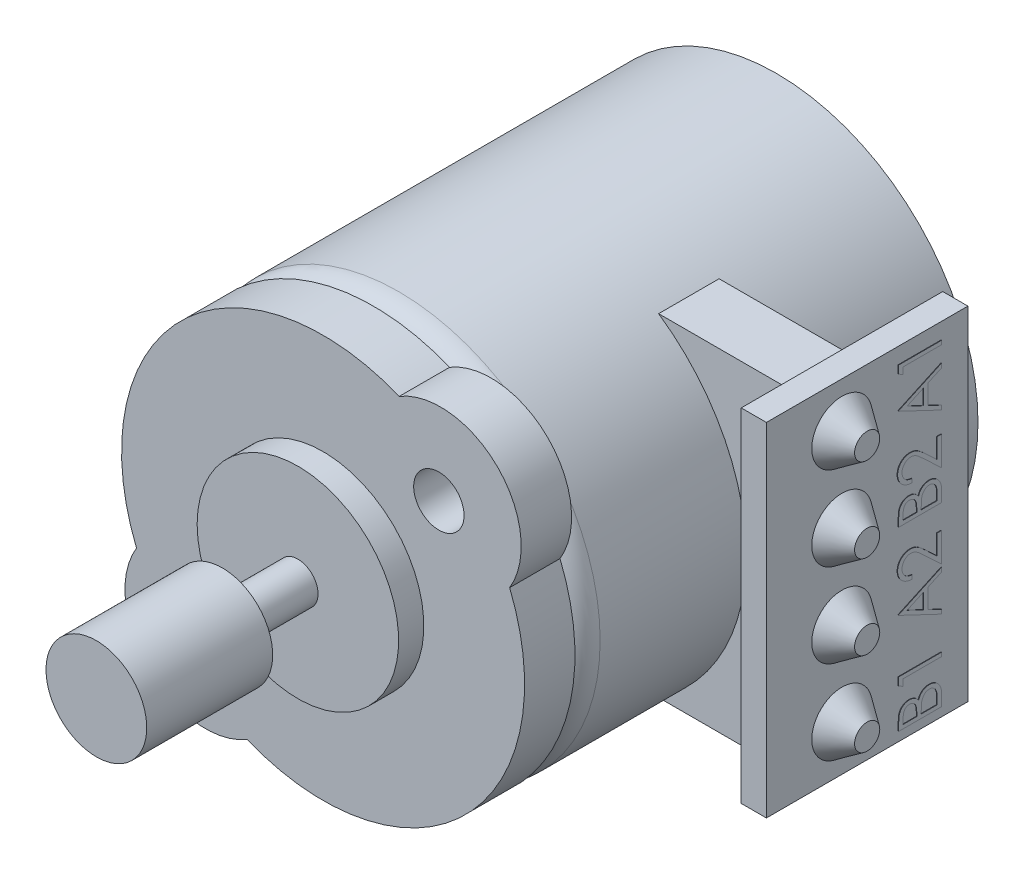
from build123d import *

# Parameters (mm, degrees)
EXTRUDE_5_DEPTH           = 1
CUT_EXTRUDE_START         = -1
SKETCH_8_R                = 0.5
CUT_EXTRUDE_1_DEPTH       = 1
SKETCH_3_W                = 1.2
SKETCH_3_H                = 6.6
EXTRUDE_1_DEPTH           = 4.8
SKETCH_4_W                = 4
SKETCH_4_H                = 6.8
EXTRUDE_2_DEPTH           = 0.5
SKETCH_5_R                = 0.6
EXTRUDE_3_DEPTH           = 0.5
EXTRUDE_3_DRAFT           = 35
EXTRUDE_3_PROFILE_2_DEPTH = 0.5
EXTRUDE_3_PROFILE_2_DRAFT = 35
EXTRUDE_3_PROFILE_3_DEPTH = 0.5
EXTRUDE_3_PROFILE_3_DRAFT = 35
EXTRUDE_3_PROFILE_4_DEPTH = 0.5
EXTRUDE_3_PROFILE_4_DRAFT = 35
EXTRUDE_4_DEPTH           = 0.01


with BuildPart() as part:
    # Эскиз2 → Повернуть1 (revolve)
    with BuildSketch(Plane(origin=(0, 0, 0), x_dir=(1, 0, 0), z_dir=(0, 1, 0))):
        with BuildLine():
            Line((0, 0), (-3.5, 0))
            Line((-3.5, 0), (-3.5, -0.2))
            Line((-3.5, -0.2), (-4, -0.2))
            Line((-4, -0.2), (-4, -7.7))
            ThreePointArc((-4, -7.7), (-3.853553391, -8.053553391), (-3.5, -8.2))
            Line((-3.5, -8.2), (-4, -8.2))
            Line((-4, -8.2), (-4, -9.2))
            Line((-4, -9.2), (-2, -9.2))
            Line((-2, -9.2), (-2, -9.7))
            Line((-2, -9.7), (-0.4, -9.7))
            Line((-0.4, -9.7), (-0.4, -11.2))
            Line((-0.4, -11.2), (-1, -11.2))
            Line((-1, -11.2), (-1, -13.7))
            Line((-1, -13.7), (0, -13.7))
            Line((0, -13.7), (0, 0))
        make_face()
    revolve(axis=Axis((0, 0, 0), (0, 0, 1)))

    # Эскиз7 → Бобышка-Вытянуть5 (add)
    with BuildSketch(Plane.XY.offset(9.2)):
        with BuildLine():
            ThreePointArc((3.703456785, 1.511425764), (3.464823228, 3.464823228), (1.511425764, 3.703456785))
            ThreePointArc((1.511425764, 3.703456785), (2.828427125, 2.828427125), (3.703456785, 1.511425764))
        make_face()
        with BuildLine():
            ThreePointArc((-1.511425764, -3.703456785), (-3.464823228, -3.464823228), (-3.703456785, -1.511425764))
            ThreePointArc((-3.703456785, -1.511425764), (-2.828427125, -2.828427125), (-1.511425764, -3.703456785))
        make_face()
    extrude(amount=-EXTRUDE_5_DEPTH)

    # Эскиз8 → Вырез-Вытянуть1 (cut)
    with BuildSketch(Plane.XY.offset(9.2).offset(CUT_EXTRUDE_START)):
        with Locations((-2.298097039, -2.298097039)):
            Circle(SKETCH_8_R)
        with Locations((2.298097039, 2.298097039)):
            Circle(SKETCH_8_R)
    extrude(amount=CUT_EXTRUDE_1_DEPTH, mode=Mode.SUBTRACT)

    # Эскиз3 → Бобышка-Вытянуть1 (add)
    with BuildSketch(Plane(origin=(0, 0, 0), x_dir=(0, 0, -1), z_dir=(1, 0, 0))):
        with Locations((-4.2, 0)):
            Rectangle(SKETCH_3_W, SKETCH_3_H)
    extrude(amount=EXTRUDE_1_DEPTH)

    # Эскиз4 → Бобышка-Вытянуть2 (add)
    with BuildSketch(Plane(origin=(4.8, 0, 0), x_dir=(0, 0, -1), z_dir=(1, 0, 0))):
        with Locations((-3.7, 0)):
            Rectangle(SKETCH_4_W, SKETCH_4_H)
    extrude(amount=EXTRUDE_2_DEPTH)


with BuildPart() as extrude_3_tool:
    # Эскиз5 → Бобышка-Вытянуть3 (with draft: the straight prism first)
    with BuildSketch(Plane(origin=(5.3, 0, 0), x_dir=(0, 0, -1), z_dir=(1, 0, 0))):
        with Locations((-4.2, -2.5)):
            Circle(SKETCH_5_R)
    extrude(amount=EXTRUDE_3_DEPTH)
    # Бобышка-Вытянуть3: the draft: its side faces are tilted about the plane it starts from
    extrude_3_sides = [extrude_3_tool.faces().sort_by_distance(p)[0] for p in [
        (5.55, -2.5, 4.8),
    ]]
    draft(extrude_3_sides, Plane(origin=(5.3, 0, 0), x_dir=(0, 0, -1), z_dir=(1, 0, 0)), EXTRUDE_3_DRAFT)


with BuildPart() as part_1:
    add(part.part)

    # Бобышка-Вытянуть3: add extrude_3_tool
    add(extrude_3_tool.part)


with BuildPart() as extrude_3_profile_2_tool:
    # Эскиз5 → Бобышка-Вытянуть3 profile 2 (with draft: the straight prism first)
    with BuildSketch(Plane(origin=(5.3, 0, 0), x_dir=(0, 0, -1), z_dir=(1, 0, 0))):
        with Locations((-4.2, -0.833333333)):
            Circle(SKETCH_5_R)
    extrude(amount=EXTRUDE_3_PROFILE_2_DEPTH)
    # Бобышка-Вытянуть3 profile 2: the draft: its side faces are tilted about the plane it starts from
    extrude_3_profile_2_sides = [extrude_3_profile_2_tool.faces().sort_by_distance(p)[0] for p in [
        (5.55, -0.833333333, 4.8),
    ]]
    draft(extrude_3_profile_2_sides, Plane(origin=(5.3, 0, 0), x_dir=(0, 0, -1), z_dir=(1, 0, 0)), EXTRUDE_3_PROFILE_2_DRAFT)


with BuildPart() as part_2:
    add(part_1.part)

    # Бобышка-Вытянуть3 profile 2: add extrude_3_profile_2_tool
    add(extrude_3_profile_2_tool.part)


with BuildPart() as extrude_3_profile_3_tool:
    # Эскиз5 → Бобышка-Вытянуть3 profile 3 (with draft: the straight prism first)
    with BuildSketch(Plane(origin=(5.3, 0, 0), x_dir=(0, 0, -1), z_dir=(1, 0, 0))):
        with Locations((-4.2, 0.833333333)):
            Circle(SKETCH_5_R)
    extrude(amount=EXTRUDE_3_PROFILE_3_DEPTH)
    # Бобышка-Вытянуть3 profile 3: the draft: its side faces are tilted about the plane it starts from
    extrude_3_profile_3_sides = [extrude_3_profile_3_tool.faces().sort_by_distance(p)[0] for p in [
        (5.55, 0.833333333, 4.8),
    ]]
    draft(extrude_3_profile_3_sides, Plane(origin=(5.3, 0, 0), x_dir=(0, 0, -1), z_dir=(1, 0, 0)), EXTRUDE_3_PROFILE_3_DRAFT)


with BuildPart() as part_3:
    add(part_2.part)

    # Бобышка-Вытянуть3 profile 3: add extrude_3_profile_3_tool
    add(extrude_3_profile_3_tool.part)


with BuildPart() as extrude_3_profile_4_tool:
    # Эскиз5 → Бобышка-Вытянуть3 profile 4 (with draft: the straight prism first)
    with BuildSketch(Plane(origin=(5.3, 0, 0), x_dir=(0, 0, -1), z_dir=(1, 0, 0))):
        with Locations((-4.2, 2.5)):
            Circle(SKETCH_5_R)
    extrude(amount=EXTRUDE_3_PROFILE_4_DEPTH)
    # Бобышка-Вытянуть3 profile 4: the draft: its side faces are tilted about the plane it starts from
    extrude_3_profile_4_sides = [extrude_3_profile_4_tool.faces().sort_by_distance(p)[0] for p in [
        (5.55, 2.5, 4.8),
    ]]
    draft(extrude_3_profile_4_sides, Plane(origin=(5.3, 0, 0), x_dir=(0, 0, -1), z_dir=(1, 0, 0)), EXTRUDE_3_PROFILE_4_DRAFT)


with BuildPart() as part_4:
    add(part_3.part)

    # Бобышка-Вытянуть3 profile 4: add extrude_3_profile_4_tool
    add(extrude_3_profile_4_tool.part)

    # Эскиз6 → Бобышка-Вытянуть4 (add)
    # profile 1 of 8: a face of its own
    with BuildSketch(Plane(origin=(5.3, 0, 0), x_dir=(0, 0, 1), z_dir=(1, 0, 0))):
        Polygon((3.083442392, -2.926812901), (3.083442392, -3.083974359), (2.233442392, -3.083974359), (2.233442392, -3.007692308), (2.996262905, -3.007692308), (2.996262905, -2.876923077), align=None)
    # profile 2 of 8: a face of its own
    with BuildSketch(Plane(origin=(5.3, 0, 0), x_dir=(0, 0, 1), z_dir=(1, 0, 0))):
        Polygon((3.083442392, -2.299358974), (2.233442392, -2.691666667), (2.233442392, -2.60874399), (2.50587829, -2.483082933), (2.50587829, -2.09775641), (2.233442392, -1.968519631), (2.233442392, -1.88525641), (3.083442392, -2.288461538), align=None)
        Polygon((2.917767312, -2.293058894), (2.593057777, -2.139132612), (2.593057777, -2.442898638), align=None, mode=Mode.SUBTRACT)
    # profile 3 of 8: a face of its own
    with BuildSketch(Plane(origin=(5.3, 0, 0), x_dir=(0, 0, 1), z_dir=(1, 0, 0))):
        with BuildLine():
            Line((2.821903931, -1.002564103), (2.821903931, -0.926282051))
            add(Edge.make_bspline(
                [(2.821903931, -0.926282051), (2.832024054, -0.926779132), (2.851899705, -0.927755386), (2.880877662, -0.932329168), (2.908579239, -0.938867619), (2.934766947, -0.948134129), (2.959753618, -0.959577459), (2.98320746, -0.973587407), (3.005361248, -0.989865303), (3.025795539, -1.008381284), (3.044475035, -1.028472831), (3.060776435, -1.050019562), (3.074391942, -1.07280002), (3.08583609, -1.096616615), (3.094415882, -1.121744793), (3.100784743, -1.147944359), (3.104615937, -1.175333729), (3.105027799, -1.193994857), (3.105237264, -1.203485577)],
                knots=[0, 0, 0, 0, 1.100776268, 2.161895295, 3.184016182, 4.190939212, 5.176500551, 6.166955529, 7.155448256, 8.160289653, 9.16017456, 10.133824356, 11.091467644, 12.04088621, 13.000931625, 13.972173743, 14.968683325, 16, 16, 16, 16], degree=3))
            add(Edge.make_bspline(
                [(3.105237264, -1.203485577), (3.105019068, -1.212805966), (3.104590319, -1.231120199), (3.100908355, -1.257849545), (3.095141568, -1.283295459), (3.087050682, -1.307408203), (3.076174464, -1.32999539), (3.063109347, -1.351226701), (3.047998817, -1.371354897), (3.030208605, -1.389473688), (3.011216597, -1.406111364), (2.990940963, -1.420464769), (2.969999565, -1.432756537), (2.948232716, -1.443002117), (2.925435467, -1.450544322), (2.901939717, -1.456270458), (2.877502263, -1.459507116), (2.8609621, -1.460003861), (2.852552969, -1.46025641)],
                knots=[0, 0, 0, 0, 1.111607364, 2.184268762, 3.212621178, 4.221274766, 5.211760367, 6.196651075, 7.1921475, 8.207485113, 9.220403448, 10.201281604, 11.166441695, 12.114753415, 13.065576456, 14.026450734, 14.996634279, 16, 16, 16, 16], degree=3))
            add(Edge.make_bspline(
                [(2.852552969, -1.46025641), (2.84071421, -1.459845189), (2.817244443, -1.459029964), (2.78275512, -1.452056472), (2.749339575, -1.441165177), (2.72244623, -1.428051533), (2.700775239, -1.414822511), (2.682932839, -1.402901259), (2.663721511, -1.388945519), (2.643205586, -1.37275217), (2.621224366, -1.354656186), (2.59779113, -1.334493661), (2.573147986, -1.312120815), (2.556316626, -1.296418037), (2.547595037, -1.28828125)],
                knots=[0, 0, 0, 0, 1.184426356, 2.348067706, 3.509069118, 4.696110526, 5.333549288, 6.050745305, 6.844228056, 7.710549037, 8.667450064, 9.695053472, 10.805634456, 12, 12, 12, 12], degree=3))
            Line((2.547595037, -1.28828125), (2.32062188, -1.075610978))
            Line((2.32062188, -1.075610978), (2.32062188, -1.471153846))
            Line((2.32062188, -1.471153846), (2.233442392, -1.471153846))
            Line((2.233442392, -1.471153846), (2.233442392, -0.893589744))
            Line((2.233442392, -0.893589744), (2.585225245, -1.223237179))
            add(Edge.make_bspline(
                [(2.585225245, -1.223237179), (2.593602948, -1.231263663), (2.609694802, -1.246680895), (2.633195532, -1.26847776), (2.654971885, -1.288086339), (2.675120357, -1.305519641), (2.693526723, -1.32079201), (2.710335232, -1.33385458), (2.725401636, -1.344765087), (2.743101018, -1.35632795), (2.764736561, -1.367353908), (2.791043331, -1.377044596), (2.818183975, -1.382911207), (2.836519264, -1.383618556), (2.845742072, -1.383974359)],
                knots=[0, 0, 0, 0, 1.329530082, 2.553755191, 3.672934919, 4.687409497, 5.60679272, 6.413407421, 7.126401618, 7.737995624, 8.834647426, 9.90044882, 10.943907757, 12, 12, 12, 12], degree=3))
            add(Edge.make_bspline(
                [(2.845742072, -1.383974359), (2.851542481, -1.38382155), (2.862973974, -1.383520394), (2.879723319, -1.380812198), (2.895942662, -1.37683332), (2.911431462, -1.37070064), (2.926494354, -1.363332452), (2.940673379, -1.353919047), (2.954451865, -1.343161998), (2.96735736, -1.330684348), (2.979180797, -1.316986207), (2.989653565, -1.302512848), (2.998405979, -1.287200803), (3.005580813, -1.271113883), (3.011209124, -1.254297135), (3.015109064, -1.23671798), (3.017557667, -1.218425005), (3.017888966, -1.205934014), (3.018057777, -1.199569311)],
                knots=[0, 0, 0, 0, 0.991504627, 1.954065223, 2.895985987, 3.842598665, 4.797835564, 5.759220273, 6.74786863, 7.784730864, 8.824135544, 9.839918996, 10.835834653, 11.835434876, 12.84861661, 13.863796685, 14.911511676, 16, 16, 16, 16], degree=3))
            add(Edge.make_bspline(
                [(3.018057777, -1.199569311), (3.017884179, -1.192922079), (3.017543261, -1.179868014), (3.015157012, -1.160702381), (3.011044305, -1.142417169), (3.005405872, -1.124975362), (2.99830704, -1.108360155), (2.989294538, -1.092721784), (2.978720248, -1.077917474), (2.966666134, -1.063974416), (2.953182179, -1.051162934), (2.938336136, -1.039669993), (2.922031432, -1.029867729), (2.904636342, -1.021178464), (2.885688352, -1.01452989), (2.865646615, -1.008846753), (2.844226386, -1.004718374), (2.829468334, -1.00329412), (2.821903931, -1.002564103)],
                knots=[0, 0, 0, 0, 1.031212865, 2.025131798, 2.990757446, 3.934781266, 4.865570067, 5.788494791, 6.729227313, 7.684356718, 8.643577152, 9.610526866, 10.590658432, 11.59095419, 12.621640561, 13.700587263, 14.82141059, 16, 16, 16, 16], degree=3))
        make_face()
    # profile 4 of 8: a face of its own
    with BuildSketch(Plane(origin=(5.3, 0, 0), x_dir=(0, 0, 1), z_dir=(1, 0, 0))):
        with BuildLine():
            Line((3.083442392, -0.294230769), (3.083442392, -0.460076122))
            add(Edge.make_bspline(
                [(3.083442392, -0.460076122), (3.08339971, -0.468194466), (3.083316981, -0.483929839), (3.082033935, -0.506811703), (3.080284473, -0.528243557), (3.077508593, -0.548231616), (3.074159161, -0.566766644), (3.070103006, -0.583904499), (3.0652394, -0.599590684), (3.057505303, -0.618318062), (3.046012534, -0.639670223), (3.029029882, -0.662789833), (3.008257712, -0.682559434), (2.98482621, -0.699604682), (2.95905038, -0.713156383), (2.931544577, -0.722960355), (2.902663583, -0.729167267), (2.882835954, -0.729805601), (2.872815389, -0.730128205)],
                knots=[0, 0, 0, 0, 1.001505555, 1.941167018, 2.826882275, 3.653841531, 4.429895133, 5.150066043, 5.825578002, 6.45369114, 7.647487171, 8.808567382, 9.977351308, 11.170798116, 12.373658725, 13.556498008, 14.765093433, 16, 16, 16, 16], degree=3))
            add(Edge.make_bspline(
                [(2.872815389, -0.730128205), (2.86342675, -0.72986784), (2.844977187, -0.729356199), (2.818036129, -0.724297084), (2.792284881, -0.716764782), (2.768040902, -0.705830106), (2.745615781, -0.691764729), (2.725142789, -0.674838671), (2.707118071, -0.654685986), (2.697083281, -0.639562868), (2.691986062, -0.63188101)],
                knots=[0, 0, 0, 0, 1.044266239, 2.052081639, 3.041743201, 4.026043445, 5.00270663, 5.980942822, 6.97441044, 8, 8, 8, 8], degree=3))
            add(Edge.make_bspline(
                [(2.691986062, -0.63188101), (2.688281709, -0.641538731), (2.681194364, -0.660016343), (2.668595841, -0.685462263), (2.655047505, -0.707473548), (2.640173733, -0.726074426), (2.6239409, -0.741742788), (2.606674061, -0.755813302), (2.587523145, -0.767601237), (2.567033461, -0.777728068), (2.545348814, -0.785697778), (2.522568379, -0.79133687), (2.498946881, -0.794801818), (2.482846429, -0.795274298), (2.474718434, -0.795512821)],
                knots=[0, 0, 0, 0, 1.272302504, 2.434229863, 3.488457646, 4.447234501, 5.35599188, 6.26022912, 7.18267843, 8.11661068, 9.06895546, 10.019249207, 11.000057067, 12, 12, 12, 12], degree=3))
            add(Edge.make_bspline(
                [(2.474718434, -0.795512821), (2.466420812, -0.795275512), (2.450095009, -0.794808601), (2.426110947, -0.791365957), (2.403193787, -0.785531266), (2.381180584, -0.777514081), (2.360195941, -0.766991194), (2.339977043, -0.754461178), (2.321062508, -0.739210561), (2.303002526, -0.722211589), (2.286773993, -0.702958425), (2.272326092, -0.682188782), (2.260389666, -0.659603924), (2.250488109, -0.635554083), (2.242814453, -0.609879446), (2.237487045, -0.582675208), (2.233889073, -0.55393546), (2.233593812, -0.534212949), (2.233442392, -0.524098558)],
                knots=[0, 0, 0, 0, 0.978404568, 1.925038397, 2.85041836, 3.763147166, 4.682162379, 5.614488577, 6.562659439, 7.54271123, 8.535210642, 9.526693784, 10.520907202, 11.541451354, 12.589717429, 13.675358278, 14.807842563, 16, 16, 16, 16], degree=3))
            Line((2.233442392, -0.524098558), (2.233442392, -0.294230769))
            Line((2.233442392, -0.294230769), (3.083442392, -0.294230769))
        make_face()
        with BuildLine():
            Line((2.996262905, -0.370512821), (2.723827008, -0.370512821))
            Line((2.723827008, -0.370512821), (2.723827008, -0.421764824))
            add(Edge.make_bspline(
                [(2.723827008, -0.421764824), (2.723923324, -0.429256741), (2.724109426, -0.443732653), (2.724659322, -0.464751767), (2.726131628, -0.484213687), (2.727688835, -0.502185476), (2.730086615, -0.51854668), (2.733020824, -0.533352071), (2.736096889, -0.546734647), (2.741342895, -0.562160682), (2.749017334, -0.579653602), (2.761207495, -0.598183192), (2.775332452, -0.614783756), (2.791931389, -0.628645018), (2.810053751, -0.640082982), (2.829701154, -0.647716183), (2.850106569, -0.653130311), (2.86415184, -0.653605095), (2.871282937, -0.653846154)],
                knots=[0, 0, 0, 0, 1.156481963, 2.23455883, 3.244418989, 4.168404366, 5.01828131, 5.794834307, 6.498111525, 7.13526334, 8.307595709, 9.435046769, 10.546766856, 11.659452936, 12.760769924, 13.837671619, 14.902137667, 16, 16, 16, 16], degree=3))
            add(Edge.make_bspline(
                [(2.871282937, -0.653846154), (2.876002847, -0.65372559), (2.885261464, -0.653489092), (2.898706408, -0.651336676), (2.911513191, -0.648213499), (2.923387266, -0.643334144), (2.934666129, -0.637433995), (2.94484881, -0.629758972), (2.954493176, -0.621091269), (2.96324511, -0.610911895), (2.971086878, -0.59927014), (2.977986946, -0.586055079), (2.983429917, -0.571108917), (2.988312551, -0.554770543), (2.991700567, -0.536778473), (2.9945334, -0.517308517), (2.995973407, -0.496195503), (2.996164254, -0.481588878), (2.996262905, -0.474038462)],
                knots=[0, 0, 0, 0, 0.911752476, 1.788502045, 2.626783689, 3.45400582, 4.26402138, 5.080402872, 5.911472738, 6.767166405, 7.66795952, 8.620018292, 9.640966946, 10.73819047, 11.913090943, 13.176185384, 14.540321519, 16, 16, 16, 16], degree=3))
            Line((2.996262905, -0.474038462), (2.996262905, -0.370512821))
        make_face(mode=Mode.SUBTRACT)
        with BuildLine():
            Line((2.636647521, -0.370512821), (2.32062188, -0.370512821))
            Line((2.32062188, -0.370512821), (2.32062188, -0.479146635))
            add(Edge.make_bspline(
                [(2.32062188, -0.479146635), (2.32071475, -0.486922698), (2.320893745, -0.501910035), (2.321484469, -0.523548392), (2.322799924, -0.54354971), (2.324944467, -0.561925498), (2.327172834, -0.578837514), (2.330257001, -0.594117736), (2.333763326, -0.607789589), (2.33918953, -0.623640436), (2.347604845, -0.641500967), (2.360375987, -0.660734962), (2.375390489, -0.678006299), (2.392986932, -0.692504722), (2.411975199, -0.704476951), (2.432255974, -0.712873774), (2.453210552, -0.71827281), (2.467534708, -0.718910807), (2.474718434, -0.719230769)],
                knots=[0, 0, 0, 0, 1.159821618, 2.235403267, 3.228114831, 4.14795534, 4.994323282, 5.771256229, 6.471395042, 7.097801288, 8.267864287, 9.404187171, 10.531774336, 11.667624178, 12.792825787, 13.866573821, 14.930062559, 16, 16, 16, 16], degree=3))
            add(Edge.make_bspline(
                [(2.474718434, -0.719230769), (2.479210255, -0.71916537), (2.488121443, -0.719035626), (2.501206814, -0.717005355), (2.513938743, -0.714172994), (2.526124705, -0.710071491), (2.537962992, -0.704899829), (2.5492474, -0.69840959), (2.560247742, -0.690914593), (2.574138682, -0.67918994), (2.590148851, -0.662152324), (2.605821658, -0.637936433), (2.618462005, -0.610403553), (2.623828998, -0.590433963), (2.626601447, -0.580118189)],
                knots=[0, 0, 0, 0, 0.723503378, 1.435336582, 2.130201219, 2.824764462, 3.504949994, 4.209866579, 4.920640069, 5.648298893, 7.13757748, 8.670694625, 10.280166878, 12, 12, 12, 12], degree=3))
            add(Edge.make_bspline(
                [(2.626601447, -0.580118189), (2.627440595, -0.575982555), (2.629260042, -0.567015648), (2.631179399, -0.552393733), (2.632901126, -0.535644762), (2.63414125, -0.516840322), (2.635472501, -0.495905626), (2.635971801, -0.4728474), (2.636581224, -0.447649343), (2.636624856, -0.43016546), (2.636647521, -0.421083734)],
                knots=[0, 0, 0, 0, 0.634452549, 1.375623993, 2.216454381, 3.166361212, 4.209414599, 5.370755378, 6.634280627, 8, 8, 8, 8], degree=3))
            Line((2.636647521, -0.421083734), (2.636647521, -0.370512821))
        make_face(mode=Mode.SUBTRACT)
    # profile 5 of 8: a face of its own
    with BuildSketch(Plane(origin=(5.3, 0, 0), x_dir=(0, 0, 1), z_dir=(1, 0, 0))):
        with BuildLine():
            Line((2.821903931, 0.653846154), (2.821903931, 0.730128205))
            add(Edge.make_bspline(
                [(2.821903931, 0.730128205), (2.832024054, 0.729631124), (2.851899705, 0.72865487), (2.880877662, 0.724081088), (2.908579239, 0.717542637), (2.934766947, 0.708276127), (2.959753618, 0.696832797), (2.98320746, 0.682822849), (3.005361248, 0.666544954), (3.025795539, 0.648028972), (3.044475035, 0.627937426), (3.060776435, 0.606390694), (3.074391942, 0.583610237), (3.08583609, 0.559793642), (3.094415882, 0.534665463), (3.100784743, 0.508465898), (3.104615937, 0.481076527), (3.105027799, 0.4624154), (3.105237264, 0.452924679)],
                knots=[0, 0, 0, 0, 1.100776268, 2.161895295, 3.184016182, 4.190939212, 5.176500551, 6.166955529, 7.155448256, 8.160289653, 9.16017456, 10.133824356, 11.091467644, 12.04088621, 13.000931625, 13.972173743, 14.968683325, 16, 16, 16, 16], degree=3))
            add(Edge.make_bspline(
                [(3.105237264, 0.452924679), (3.105019068, 0.44360429), (3.104590319, 0.425290058), (3.100908355, 0.398560711), (3.095141568, 0.373114797), (3.087050682, 0.349002054), (3.076174464, 0.326414867), (3.063109347, 0.305183556), (3.047998817, 0.285055359), (3.030208605, 0.266936569), (3.011216597, 0.250298892), (2.990940963, 0.235945487), (2.969999565, 0.223653719), (2.948232716, 0.21340814), (2.925435467, 0.205865935), (2.901939717, 0.200139798), (2.877502263, 0.196903141), (2.8609621, 0.196406395), (2.852552969, 0.196153846)],
                knots=[0, 0, 0, 0, 1.111607364, 2.184268762, 3.212621178, 4.221274766, 5.211760367, 6.196651075, 7.1921475, 8.207485113, 9.220403448, 10.201281604, 11.166441695, 12.114753415, 13.065576456, 14.026450734, 14.996634279, 16, 16, 16, 16], degree=3))
            add(Edge.make_bspline(
                [(2.852552969, 0.196153846), (2.84071421, 0.196565067), (2.817244443, 0.197380293), (2.78275512, 0.204353784), (2.749339575, 0.21524508), (2.72244623, 0.228358724), (2.700775239, 0.241587746), (2.682932839, 0.253508998), (2.663721511, 0.267464737), (2.643205586, 0.283658087), (2.621224366, 0.30175407), (2.59779113, 0.321916595), (2.573147986, 0.344289441), (2.556316626, 0.35999222), (2.547595037, 0.368129006)],
                knots=[0, 0, 0, 0, 1.184426356, 2.348067706, 3.509069118, 4.696110526, 5.333549288, 6.050745305, 6.844228056, 7.710549037, 8.667450064, 9.695053472, 10.805634456, 12, 12, 12, 12], degree=3))
            Line((2.547595037, 0.368129006), (2.32062188, 0.580799279))
            Line((2.32062188, 0.580799279), (2.32062188, 0.18525641))
            Line((2.32062188, 0.18525641), (2.233442392, 0.18525641))
            Line((2.233442392, 0.18525641), (2.233442392, 0.762820513))
            Line((2.233442392, 0.762820513), (2.585225245, 0.433173077))
            add(Edge.make_bspline(
                [(2.585225245, 0.433173077), (2.593602948, 0.425146593), (2.609694802, 0.409729361), (2.633195532, 0.387932497), (2.654971885, 0.368323917), (2.675120357, 0.350890615), (2.693526723, 0.335618247), (2.710335232, 0.322555676), (2.725401636, 0.31164517), (2.743101018, 0.300082306), (2.764736561, 0.289056349), (2.791043331, 0.27936566), (2.818183975, 0.273499049), (2.836519264, 0.2727917), (2.845742072, 0.272435897)],
                knots=[0, 0, 0, 0, 1.329530082, 2.553755191, 3.672934919, 4.687409497, 5.60679272, 6.413407421, 7.126401618, 7.737995624, 8.834647426, 9.90044882, 10.943907757, 12, 12, 12, 12], degree=3))
            add(Edge.make_bspline(
                [(2.845742072, 0.272435897), (2.851542481, 0.272588706), (2.862973974, 0.272889863), (2.879723319, 0.275598059), (2.895942662, 0.279576936), (2.911431462, 0.285709616), (2.926494354, 0.293077805), (2.940673379, 0.302491209), (2.954451865, 0.313248259), (2.96735736, 0.325725908), (2.979180797, 0.339424049), (2.989653565, 0.353897408), (2.998405979, 0.369209454), (3.005580813, 0.385296374), (3.011209124, 0.402113121), (3.015109064, 0.419692276), (3.017557667, 0.437985251), (3.017888966, 0.450476243), (3.018057777, 0.456840946)],
                knots=[0, 0, 0, 0, 0.991504627, 1.954065223, 2.895985987, 3.842598665, 4.797835564, 5.759220273, 6.74786863, 7.784730864, 8.824135544, 9.839918996, 10.835834653, 11.835434876, 12.84861661, 13.863796685, 14.911511676, 16, 16, 16, 16], degree=3))
            add(Edge.make_bspline(
                [(3.018057777, 0.456840946), (3.017884179, 0.463488177), (3.017543261, 0.476542243), (3.015157012, 0.495707875), (3.011044305, 0.513993088), (3.005405872, 0.531434895), (2.99830704, 0.548050101), (2.989294538, 0.563688473), (2.978720248, 0.578492783), (2.966666134, 0.59243584), (2.953182179, 0.605247323), (2.938336136, 0.616740263), (2.922031432, 0.626542527), (2.904636342, 0.635231792), (2.885688352, 0.641880366), (2.865646615, 0.647563504), (2.844226386, 0.651691882), (2.829468334, 0.653116137), (2.821903931, 0.653846154)],
                knots=[0, 0, 0, 0, 1.031212865, 2.025131798, 2.990757446, 3.934781266, 4.865570067, 5.788494791, 6.729227313, 7.684356718, 8.643577152, 9.610526866, 10.590658432, 11.59095419, 12.621640561, 13.700587263, 14.82141059, 16, 16, 16, 16], degree=3))
        make_face()
    # profile 6 of 8: a face of its own
    with BuildSketch(Plane(origin=(5.3, 0, 0), x_dir=(0, 0, 1), z_dir=(1, 0, 0))):
        Polygon((3.083442392, 1.209615385), (2.233442392, 0.817307692), (2.233442392, 0.900230369), (2.50587829, 1.025891426), (2.50587829, 1.411217949), (2.233442392, 1.540454728), (2.233442392, 1.623717949), (3.083442392, 1.220512821), align=None)
        Polygon((2.917767312, 1.215915465), (2.593057777, 1.369841747), (2.593057777, 1.066075721), align=None, mode=Mode.SUBTRACT)
    # profile 7 of 8: a face of its own
    with BuildSketch(Plane(origin=(5.3, 0, 0), x_dir=(0, 0, 1), z_dir=(1, 0, 0))):
        Polygon((3.083442392, 2.434725561), (3.083442392, 2.277564103), (2.233442392, 2.277564103), (2.233442392, 2.353846154), (2.996262905, 2.353846154), (2.996262905, 2.484615385), align=None)
    # profile 8 of 8: a face of its own
    with BuildSketch(Plane(origin=(5.3, 0, 0), x_dir=(0, 0, 1), z_dir=(1, 0, 0))):
        with BuildLine():
            Line((3.083442392, 3.21474359), (3.083442392, 3.048898237))
            add(Edge.make_bspline(
                [(3.083442392, 3.048898237), (3.08339971, 3.040779892), (3.083316981, 3.02504452), (3.082033935, 3.002162656), (3.080284473, 2.980730802), (3.077508593, 2.960742743), (3.074159161, 2.942207715), (3.070103006, 2.92506986), (3.0652394, 2.909383675), (3.057505303, 2.890656296), (3.046012534, 2.869304136), (3.029029882, 2.846184526), (3.008257712, 2.826414925), (2.98482621, 2.809369677), (2.95905038, 2.795817976), (2.931544577, 2.786014004), (2.902663583, 2.779807092), (2.882835954, 2.779168758), (2.872815389, 2.778846154)],
                knots=[0, 0, 0, 0, 1.001505555, 1.941167018, 2.826882275, 3.653841531, 4.429895133, 5.150066043, 5.825578002, 6.45369114, 7.647487171, 8.808567382, 9.977351308, 11.170798116, 12.373658725, 13.556498008, 14.765093433, 16, 16, 16, 16], degree=3))
            add(Edge.make_bspline(
                [(2.872815389, 2.778846154), (2.86342675, 2.779106518), (2.844977187, 2.77961816), (2.818036129, 2.784677275), (2.792284881, 2.792209577), (2.768040902, 2.803144253), (2.745615781, 2.81720963), (2.725142789, 2.834135688), (2.707118071, 2.854288373), (2.697083281, 2.869411491), (2.691986062, 2.877093349)],
                knots=[0, 0, 0, 0, 1.044266239, 2.052081639, 3.041743201, 4.026043445, 5.00270663, 5.980942822, 6.97441044, 8, 8, 8, 8], degree=3))
            add(Edge.make_bspline(
                [(2.691986062, 2.877093349), (2.688281709, 2.867435628), (2.681194364, 2.848958016), (2.668595841, 2.823512096), (2.655047505, 2.801500811), (2.640173733, 2.782899933), (2.6239409, 2.767231571), (2.606674061, 2.753161057), (2.587523145, 2.741373121), (2.567033461, 2.731246291), (2.545348814, 2.723276581), (2.522568379, 2.717637489), (2.498946881, 2.714172541), (2.482846429, 2.713700061), (2.474718434, 2.713461538)],
                knots=[0, 0, 0, 0, 1.272302504, 2.434229863, 3.488457646, 4.447234501, 5.35599188, 6.26022912, 7.18267843, 8.11661068, 9.06895546, 10.019249207, 11.000057067, 12, 12, 12, 12], degree=3))
            add(Edge.make_bspline(
                [(2.474718434, 2.713461538), (2.466420812, 2.713698847), (2.450095009, 2.714165758), (2.426110947, 2.717608402), (2.403193787, 2.723443093), (2.381180584, 2.731460278), (2.360195941, 2.741983165), (2.339977043, 2.754513181), (2.321062508, 2.769763798), (2.303002526, 2.78676277), (2.286773993, 2.806015934), (2.272326092, 2.826785577), (2.260389666, 2.849370435), (2.250488109, 2.873420276), (2.242814453, 2.899094913), (2.237487045, 2.926299151), (2.233889073, 2.955038899), (2.233593812, 2.97476141), (2.233442392, 2.984875801)],
                knots=[0, 0, 0, 0, 0.978404568, 1.925038397, 2.85041836, 3.763147166, 4.682162379, 5.614488577, 6.562659439, 7.54271123, 8.535210642, 9.526693784, 10.520907202, 11.541451354, 12.589717429, 13.675358278, 14.807842563, 16, 16, 16, 16], degree=3))
            Line((2.233442392, 2.984875801), (2.233442392, 3.21474359))
            Line((2.233442392, 3.21474359), (3.083442392, 3.21474359))
        make_face()
        with BuildLine():
            Line((2.996262905, 3.138461538), (2.723827008, 3.138461538))
            Line((2.723827008, 3.138461538), (2.723827008, 3.087209535))
            add(Edge.make_bspline(
                [(2.723827008, 3.087209535), (2.723923324, 3.079717617), (2.724109426, 3.065241706), (2.724659322, 3.044222592), (2.726131628, 3.024760672), (2.727688835, 3.006788883), (2.730086615, 2.990427679), (2.733020824, 2.975622288), (2.736096889, 2.962239712), (2.741342895, 2.946813677), (2.749017334, 2.929320757), (2.761207495, 2.910791167), (2.775332452, 2.894190603), (2.791931389, 2.880329341), (2.810053751, 2.868891377), (2.829701154, 2.861258176), (2.850106569, 2.855844047), (2.86415184, 2.855369264), (2.871282937, 2.855128205)],
                knots=[0, 0, 0, 0, 1.156481963, 2.23455883, 3.244418989, 4.168404366, 5.01828131, 5.794834307, 6.498111525, 7.13526334, 8.307595709, 9.435046769, 10.546766856, 11.659452936, 12.760769924, 13.837671619, 14.902137667, 16, 16, 16, 16], degree=3))
            add(Edge.make_bspline(
                [(2.871282937, 2.855128205), (2.876002847, 2.855248769), (2.885261464, 2.855485267), (2.898706408, 2.857637683), (2.911513191, 2.86076086), (2.923387266, 2.865640215), (2.934666129, 2.871540364), (2.94484881, 2.879215387), (2.954493176, 2.88788309), (2.96324511, 2.898062464), (2.971086878, 2.909704219), (2.977986946, 2.92291928), (2.983429917, 2.937865442), (2.988312551, 2.954203816), (2.991700567, 2.972195886), (2.9945334, 2.991665842), (2.995973407, 3.012778856), (2.996164254, 3.027385481), (2.996262905, 3.034935897)],
                knots=[0, 0, 0, 0, 0.911752476, 1.788502045, 2.626783689, 3.45400582, 4.26402138, 5.080402872, 5.911472738, 6.767166405, 7.66795952, 8.620018292, 9.640966946, 10.73819047, 11.913090943, 13.176185384, 14.540321519, 16, 16, 16, 16], degree=3))
            Line((2.996262905, 3.034935897), (2.996262905, 3.138461538))
        make_face(mode=Mode.SUBTRACT)
        with BuildLine():
            Line((2.636647521, 3.138461538), (2.32062188, 3.138461538))
            Line((2.32062188, 3.138461538), (2.32062188, 3.029827724))
            add(Edge.make_bspline(
                [(2.32062188, 3.029827724), (2.32071475, 3.022051661), (2.320893745, 3.007064324), (2.321484469, 2.985425967), (2.322799924, 2.965424649), (2.324944467, 2.947048861), (2.327172834, 2.930136845), (2.330257001, 2.914856623), (2.333763326, 2.901184769), (2.33918953, 2.885333923), (2.347604845, 2.867473392), (2.360375987, 2.848239397), (2.375390489, 2.83096806), (2.392986932, 2.816469637), (2.411975199, 2.804497408), (2.432255974, 2.796100585), (2.453210552, 2.790701549), (2.467534708, 2.790063552), (2.474718434, 2.78974359)],
                knots=[0, 0, 0, 0, 1.159821618, 2.235403267, 3.228114831, 4.14795534, 4.994323282, 5.771256229, 6.471395042, 7.097801288, 8.267864287, 9.404187171, 10.531774336, 11.667624178, 12.792825787, 13.866573821, 14.930062559, 16, 16, 16, 16], degree=3))
            add(Edge.make_bspline(
                [(2.474718434, 2.78974359), (2.479210255, 2.789808989), (2.488121443, 2.789938733), (2.501206814, 2.791969004), (2.513938743, 2.794801365), (2.526124705, 2.798902868), (2.537962992, 2.80407453), (2.5492474, 2.810564769), (2.560247742, 2.818059766), (2.574138682, 2.829784419), (2.590148851, 2.846822035), (2.605821658, 2.871037926), (2.618462005, 2.898570806), (2.623828998, 2.918540396), (2.626601447, 2.92885617)],
                knots=[0, 0, 0, 0, 0.723503378, 1.435336582, 2.130201219, 2.824764462, 3.504949994, 4.209866579, 4.920640069, 5.648298893, 7.13757748, 8.670694625, 10.280166878, 12, 12, 12, 12], degree=3))
            add(Edge.make_bspline(
                [(2.626601447, 2.92885617), (2.627440595, 2.932991804), (2.629260042, 2.94195871), (2.631179399, 2.956580626), (2.632901126, 2.973329597), (2.63414125, 2.992134037), (2.635472501, 3.013068733), (2.635971801, 3.036126959), (2.636581224, 3.061325016), (2.636624856, 3.078808899), (2.636647521, 3.087890625)],
                knots=[0, 0, 0, 0, 0.634452549, 1.375623993, 2.216454381, 3.166361212, 4.209414599, 5.370755378, 6.634280627, 8, 8, 8, 8], degree=3))
            Line((2.636647521, 3.087890625), (2.636647521, 3.138461538))
        make_face(mode=Mode.SUBTRACT)
    extrude(amount=EXTRUDE_4_DEPTH)


solid = part_4.part
